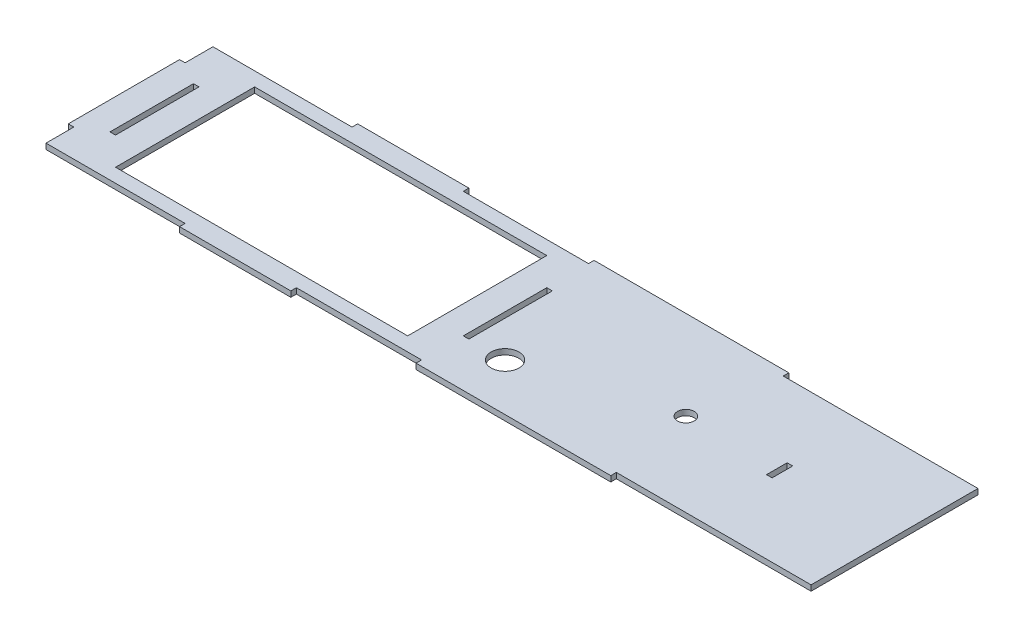
from build123d import *

# Parameters (mm, degrees)
SKETCH_1_R      = 5
SKETCH_1_W      = 2
SKETCH_1_H      = 30
SKETCH_1_W_2    = 105
SKETCH_1_H_2    = 50
SKETCH_1_R_2    = 3
SKETCH_1_H_3    = 7.4
SKETCH_1_W_3    = 40
SKETCH_1_H_4    = 2
SKETCH_1_W_4    = 70
EXTRUDE_1_DEPTH = 2


with BuildPart() as part:
    # 草图1 → 凸台-拉伸1 (new body)
    # profile 1 of 5: a face of its own
    with BuildSketch(Plane(origin=(0, 0, 0), x_dir=(1, 0, 0), z_dir=(0, 1, 0))):
        Polygon((-2, 20), (-2, -20), (0, -20), (0, -30), (50, -30), (90, -30), (135, -30), (205, -30), (275, -30), (275, 30), (205, 30), (135, 30), (90, 30), (50, 30), (0, 30), (0, 20), align=None)
        with Locations(Location((150, -15, 0), (0, 0, 270))):
            Circle(SKETCH_1_R, mode=Mode.SUBTRACT)
        with Locations((9, 0)):
            Rectangle(SKETCH_1_W, SKETCH_1_H, mode=Mode.SUBTRACT)
        with Locations((72.5, 0)):
            Rectangle(SKETCH_1_W_2, SKETCH_1_H_2, mode=Mode.SUBTRACT)
        with Locations((136, 0)):
            Rectangle(SKETCH_1_W, SKETCH_1_H, mode=Mode.SUBTRACT)
        with Locations(Location((200, 0, 0), (0, 0, 270))):
            Circle(SKETCH_1_R_2, mode=Mode.SUBTRACT)
        with Locations((233.7, 0)):
            Rectangle(SKETCH_1_W, SKETCH_1_H_3, mode=Mode.SUBTRACT)
    # profile 2 of 5: a face of its own
    with BuildSketch(Plane(origin=(0, 0, 0), x_dir=(1, 0, 0), z_dir=(0, 1, 0))):
        with Locations((70, 31)):
            Rectangle(SKETCH_1_W_3, SKETCH_1_H_4)
    # profile 3 of 5: a face of its own
    with BuildSketch(Plane(origin=(0, 0, 0), x_dir=(1, 0, 0), z_dir=(0, 1, 0))):
        with Locations((170, 31)):
            Rectangle(SKETCH_1_W_4, SKETCH_1_H_4)
    # profile 4 of 5: a face of its own
    with BuildSketch(Plane(origin=(0, 0, 0), x_dir=(1, 0, 0), z_dir=(0, 1, 0))):
        with Locations((70, -31)):
            Rectangle(SKETCH_1_W_3, SKETCH_1_H_4)
    # profile 5 of 5: a face of its own
    with BuildSketch(Plane(origin=(0, 0, 0), x_dir=(1, 0, 0), z_dir=(0, 1, 0))):
        with Locations((170, -31)):
            Rectangle(SKETCH_1_W_4, SKETCH_1_H_4)
    extrude(amount=EXTRUDE_1_DEPTH)


solid = part.part
